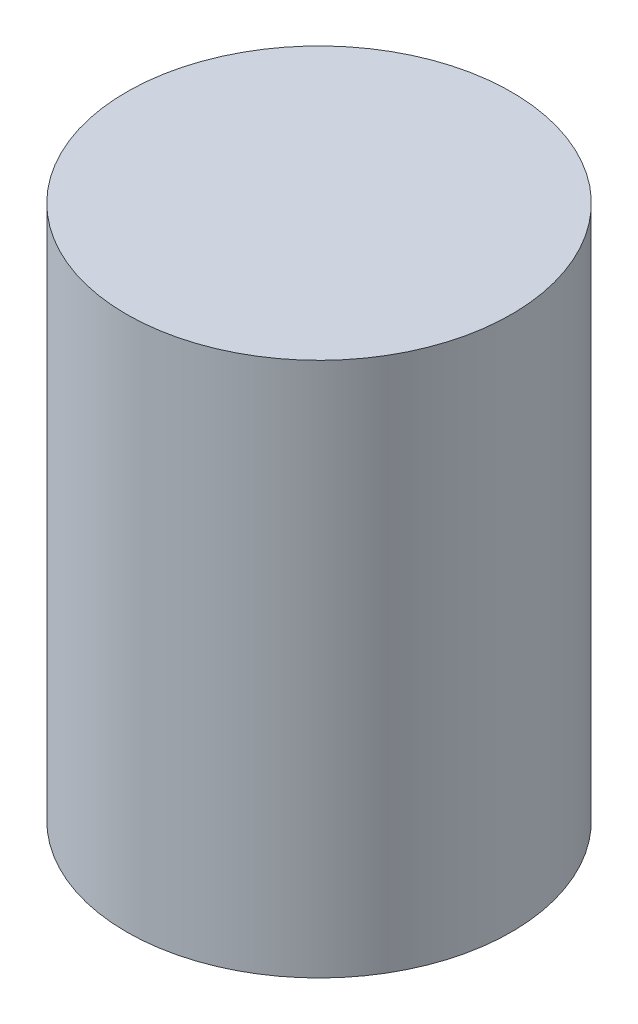
from build123d import *

# Parameters (mm, degrees)
SKETCH1_R           = 64.000000016
BOSS_EXTRUDE1_DEPTH = 177.8


with BuildPart() as part:
    # Sketch1 → Boss-Extrude1 (new body)
    with BuildSketch(Plane(origin=(0, 0, 0), x_dir=(1, 0, 0), z_dir=(0, 1, 0))):
        with Locations(Location((0, 0, 0), (0, 0, 270))):
            Circle(SKETCH1_R)
    extrude(amount=BOSS_EXTRUDE1_DEPTH)


solid = part.part
